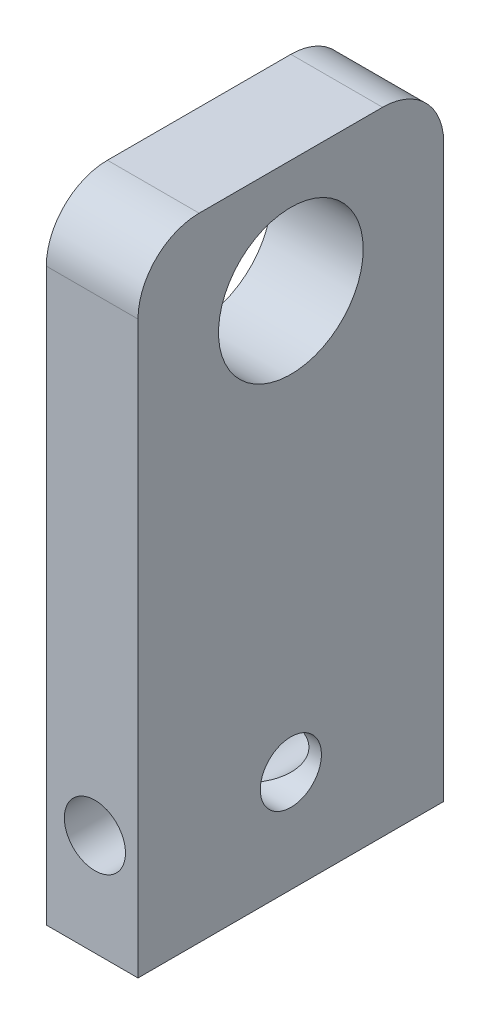
from build123d import *

# Parameters (mm, degrees)
SKETCH1_W           = 4.5
SKETCH1_H           = 15
BOSS_EXTRUDE1_DEPTH = 31
SKETCH2_R           = 3.55
CUT_EXTRUDE1_DEPTH  = 20
SKETCH3_R           = 1.5
CUT_EXTRUDE2_DEPTH  = 20
SKETCH4_R           = 1.5
CUT_EXTRUDE3_DEPTH  = 20
FILLET1_R           = 3
FILLET2_R           = 3


with BuildPart() as part:
    # Sketch1 → Boss-Extrude1 (new body)
    with BuildSketch(Plane(origin=(0, 0, 0), x_dir=(1, 0, 0), z_dir=(0, 1, 0))):
        with Locations((-0.136363636, 6.163636364)):
            Rectangle(SKETCH1_W, SKETCH1_H)
    extrude(amount=BOSS_EXTRUDE1_DEPTH)

    # Sketch2 → Cut-Extrude1 (cut)
    with BuildSketch(Plane(origin=(2.113636364, 0, 0), x_dir=(0, 0, -1), z_dir=(1, 0, 0))):
        with Locations((6.163636364, 25.45)):
            Circle(SKETCH2_R)
    extrude(amount=-CUT_EXTRUDE1_DEPTH, mode=Mode.SUBTRACT)

    # Sketch3 → Cut-Extrude2 (cut)
    with BuildSketch(Plane.ZY.offset(2.386363636)):
        with Locations((-6.163636364, 5)):
            Circle(SKETCH3_R)
    extrude(amount=-CUT_EXTRUDE2_DEPTH, mode=Mode.SUBTRACT)

    # Sketch4 → Cut-Extrude3 (cut)
    with BuildSketch(Plane(origin=(0, 0, -13.663636364), x_dir=(-1, 0, 0), z_dir=(0, 0, -1))):
        with Locations((0, 5)):
            Circle(SKETCH4_R)
    extrude(amount=-CUT_EXTRUDE3_DEPTH, mode=Mode.SUBTRACT)

    # Fillet1
    fillet1_edges = [part.edges().sort_by_distance(p)[0] for p in [
        (-0.136363636, 31, 1.336363636),
    ]]
    fillet(fillet1_edges, radius=FILLET1_R)

    # Fillet2
    fillet2_edges = [part.edges().sort_by_distance(p)[0] for p in [
        (-0.136363636, 31, -13.663636364),
    ]]
    fillet(fillet2_edges, radius=FILLET2_R)


solid = part.part
